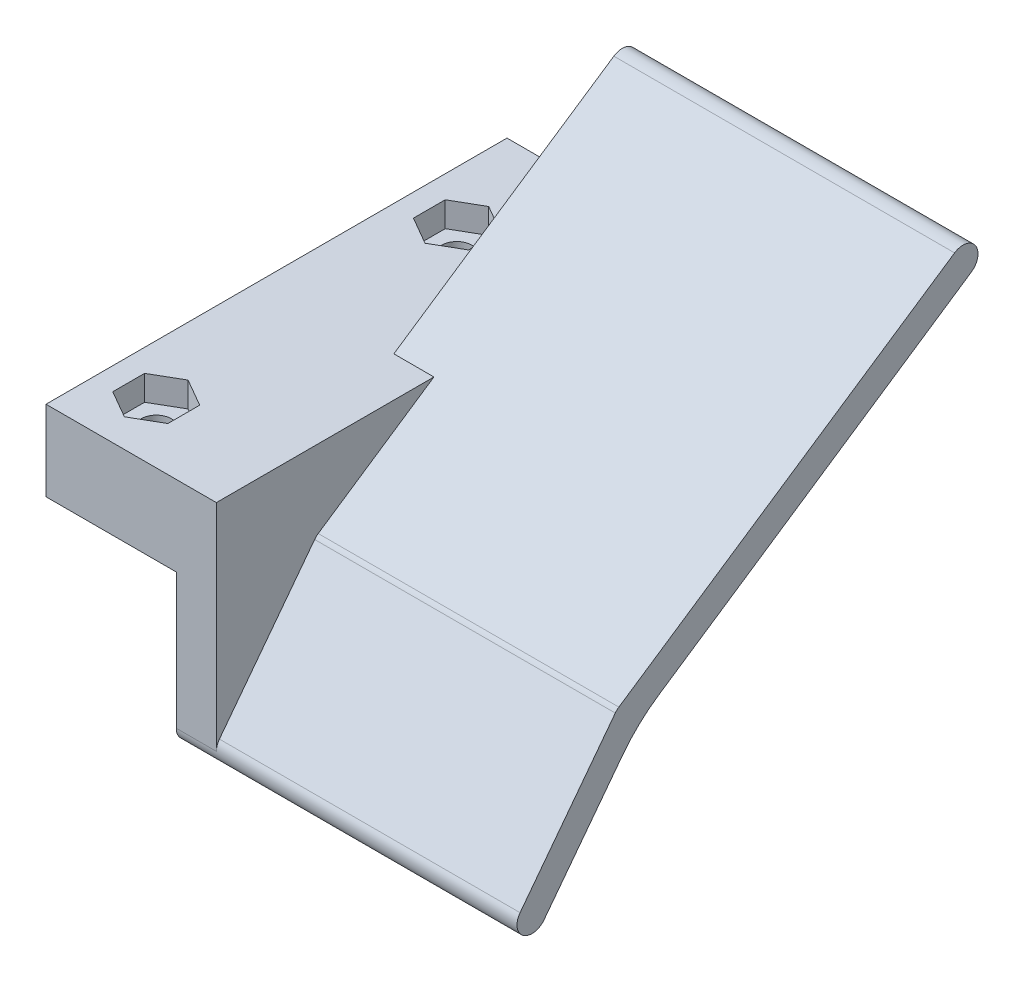
from build123d import *
from build123d.topology import SkipClean

# Parameters (mm, degrees)
SKETCH_1_W           = 13
SKETCH_1_H           = 46
SKETCH_1_R           = 1.5
EXTRUDE_1_DEPTH      = 8
EXTRUDE_2_DEPTH      = 15
EXTRUDE_2_DEPTH_BACK = 23
SKETCH_2_W           = 4
SKETCH_2_H           = 46
EXTRUDE_3_DEPTH      = 30
CUT_EXTRUDE_1_REACH  = 61.54
FILLET_1_R           = 15
CUT_EXTRUDE_2_DEPTH  = 2.5


with BuildPart() as part:
    # 草图1 → 凸台-拉伸1 (new body)
    with BuildSketch(Plane(origin=(0, 0, 0), x_dir=(1, 0, 0), z_dir=(0, 1, 0))):
        with Locations((62.5, -23)):
            Rectangle(SKETCH_1_W, SKETCH_1_H)
        with Locations(Location((61, -10, 0), (0, 0, 270))):
            Circle(SKETCH_1_R, mode=Mode.SUBTRACT)
        with Locations(Location((61, -40, 0), (0, 0, 270))):
            Circle(SKETCH_1_R, mode=Mode.SUBTRACT)
    extrude(amount=-EXTRUDE_1_DEPTH)

    # 草图2 → 凸台-拉伸2 (add, two sides: drawn at the far end of the back side and taken through both)
    with BuildSketch(Plane(origin=(0, 0, 0), x_dir=(1, 0, 0), z_dir=(0, 1, 0)).offset(-EXTRUDE_2_DEPTH_BACK)):
        with Locations((71, -23)):
            Rectangle(SKETCH_2_W, SKETCH_2_H)
    extrude(amount=EXTRUDE_2_DEPTH + EXTRUDE_2_DEPTH_BACK)

    # 草图4 → 凸台-拉伸3 (add)
    with BuildSketch(Plane(origin=(73, 0, 0), x_dir=(0, 0, -1), z_dir=(1, 0, 0))):
        with BuildLine():
            ThreePointArc((-0.663665725, 12.25479119), (-0.176273928, 12.794486508), (0, 13.50000001))
            ThreePointArc((0, 13.50000001), (-0.439339832, 14.560660175), (-1.5, 15))
            ThreePointArc((-1.5, 15), (-1.937142303, 14.934889058), (-2.336334275, 14.74520881))
            Line((-2.336334275, 14.74520881), (-35.836334275, -7.75479119))
            ThreePointArc((-35.836334275, -7.75479119), (-33.908808925, -7.970776002), (-33.805756709, -9.907624901))
            Line((-33.805756709, -9.907624901), (-33.956649522, -10.106168077))
            Line((-33.956649522, -10.106168077), (-0.663665725, 12.25479119))
        make_face()
        with BuildLine():
            Line((-34.163665725, -10.24520881), (-33.956649522, -10.106168077))
            Line((-33.956649522, -10.106168077), (-33.805756709, -9.907624901))
            ThreePointArc((-33.805756709, -9.907624901), (-33.908808925, -7.970776002), (-35.836334275, -7.75479119))
            ThreePointArc((-35.836334275, -7.75479119), (-36.029223998, -7.908808925), (-36.194243291, -8.092375099))
            ThreePointArc((-36.194243291, -8.092375099), (-36.091191075, -10.029223998), (-34.163665725, -10.24520881))
        make_face()
        with BuildLine():
            ThreePointArc((-46, -21.5), (-45.560660172, -22.560660172), (-44.5, -23))
            ThreePointArc((-44.5, -23), (-43.833455685, -22.843770321), (-43.305756709, -22.407624901))
            Line((-43.305756709, -22.407624901), (-33.956649522, -10.106168077))
            Line((-33.956649522, -10.106168077), (-34.163665725, -10.24520881))
            ThreePointArc((-34.163665725, -10.24520881), (-36.091191075, -10.029223998), (-36.194243291, -8.092375099))
            Line((-36.194243291, -8.092375099), (-45.694243291, -20.592375099))
            ThreePointArc((-45.694243291, -20.592375099), (-45.921507112, -21.021128899), (-46, -21.5))
        make_face()
    extrude(amount=EXTRUDE_3_DEPTH)

    # 草图5 → 切除-拉伸1 (cut, up to next)
    with BuildSketch(Plane(origin=(73, 0, 0), x_dir=(0, 0, -1), z_dir=(1, 0, 0)), mode=Mode.PRIVATE) as cut_extrude_1_sk1:
        with BuildLine():
            Line((-46, 15), (-46, 0))
            Line((-46, 0), (-24.290311837, 0))
            Line((-24.290311837, 0), (-2.336334275, 14.74520881))
            ThreePointArc((-2.336334275, 14.74520881), (-1.937142303, 14.934889058), (-1.5, 15))
            Line((-1.5, 15), (-46, 15))
        make_face()
    cut_extrude_1_tool1 = extrude(cut_extrude_1_sk1.sketch, amount=-CUT_EXTRUDE_1_REACH, mode=Mode.PRIVATE) & part.part
    # 草图5 → 切除-拉伸1 (cut, up to next)
    with BuildSketch(Plane(origin=(73, 0, 0), x_dir=(0, 0, -1), z_dir=(1, 0, 0)), mode=Mode.PRIVATE) as cut_extrude_1_sk2:
        with BuildLine():
            ThreePointArc((-44.5, -23), (-43.833455685, -22.843770321), (-43.305756709, -22.407624901))
            Line((-43.305756709, -22.407624901), (-33.956649522, -10.106168077))
            Line((-33.956649522, -10.106168077), (-30.820799275, -8))
            Line((-30.820799275, -8), (0, -8))
            Line((0, -8), (0, -23))
            Line((0, -23), (-44.5, -23))
        make_face()
    cut_extrude_1_tool2 = extrude(cut_extrude_1_sk2.sketch, amount=-CUT_EXTRUDE_1_REACH, mode=Mode.PRIVATE) & part.part
    # 草图5 → 切除-拉伸1 (cut, up to next)
    with BuildSketch(Plane(origin=(73, 0, 0), x_dir=(0, 0, -1), z_dir=(1, 0, 0)), mode=Mode.PRIVATE) as cut_extrude_1_sk3:
        with BuildLine():
            ThreePointArc((-46, -21.5), (-45.560660172, -22.560660172), (-44.5, -23))
            Line((-44.5, -23), (-46, -23))
            Line((-46, -23), (-46, -21.5))
        make_face()
    cut_extrude_1_tool3 = extrude(cut_extrude_1_sk3.sketch, amount=-CUT_EXTRUDE_1_REACH, mode=Mode.PRIVATE) & part.part
    # 草图5 → 切除-拉伸1 (cut, up to next)
    with BuildSketch(Plane(origin=(73, 0, 0), x_dir=(0, 0, -1), z_dir=(1, 0, 0)), mode=Mode.PRIVATE) as cut_extrude_1_sk4:
        with BuildLine():
            ThreePointArc((0, 13.5), (-0.439339828, 14.560660172), (-1.5, 15))
            Line((-1.5, 15), (0, 15))
            Line((0, 15), (0, 13.5))
        make_face()
    cut_extrude_1_tool4 = extrude(cut_extrude_1_sk4.sketch, amount=-CUT_EXTRUDE_1_REACH, mode=Mode.PRIVATE) & part.part
    add(cut_extrude_1_tool1.solids().sort_by_distance((73, 8.34941, 28.928584))[0], mode=Mode.SUBTRACT)
    add(cut_extrude_1_tool2.solids().sort_by_distance((73, -15.8958, 19.13623))[0], mode=Mode.SUBTRACT)
    add(cut_extrude_1_tool3.solids().sort_by_distance((73, -22.664948, 45.664948))[0], mode=Mode.SUBTRACT)
    add(cut_extrude_1_tool4.solids().sort_by_distance((73, 14.664948, 0.335052))[0], mode=Mode.SUBTRACT)

    # 圆角1
    fillet_1_edges = [part.edges().sort_by_distance(p)[0] for p in [
        (88, -10.106168077, 33.956649522),
    ]]
    fillet(fillet_1_edges, radius=FILLET_1_R)

    # 草图6 → 切除-拉伸2 (cut)
    with SkipClean():  # the faces are left unmerged after this step: merging them gives an invalid solid
        with BuildSketch(Plane(origin=(0, 0, 0), x_dir=(1, 0, 0), z_dir=(0, 1, 0))):
            Polygon((63.75, -11.58771324), (63.75, -8.41228676), (61, -6.824573519), (58.25, -8.41228676), (58.25, -11.58771324), (61, -13.175426481), align=None)
            Polygon((61, -43.175426481), (63.75, -41.58771324), (63.75, -38.41228676), (61, -36.824573519), (58.25, -38.41228676), (58.25, -41.58771324), align=None)
        extrude(amount=-CUT_EXTRUDE_2_DEPTH, mode=Mode.SUBTRACT)


solid = part.part
